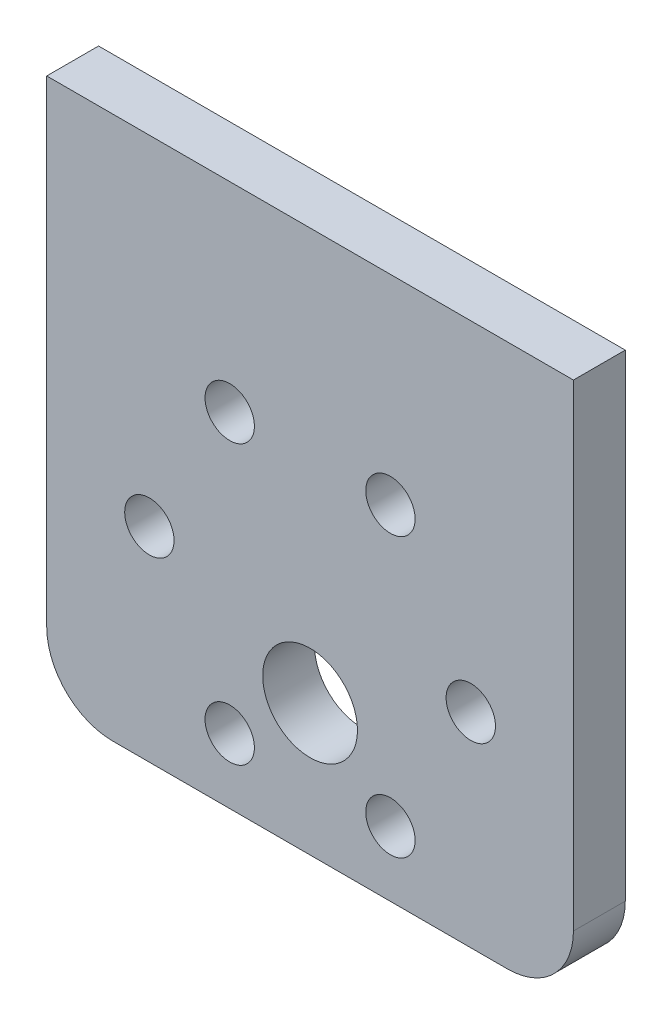
from build123d import *

# Parameters (mm, degrees)
SKETCH1_W                      = 50.8
SKETCH1_H                      = 52.3748
BOSS_EXTRUDE1_DEPTH            = 2.5
F_1_2_0_5_DIAMETER_HOLE1_D     = 9.144
F_3_16_0_1875_DIAMETER_HOLE1_D = 4.7625
FILLET1_R                      = 6.35


with BuildPart() as part:
    # Sketch1 → Boss-Extrude1 (new, symmetric)
    with BuildSketch(Plane.XY):
        Rectangle(SKETCH1_W, SKETCH1_H)
    extrude(amount=BOSS_EXTRUDE1_DEPTH, both=True)

    # 1/2 (0.5) Diameter Hole1 (through all)
    with Locations(Plane.XY.offset(2.5)):
        with Locations((0, -13.4874)):
            Hole(F_1_2_0_5_DIAMETER_HOLE1_D / 2)

    # 3/16 (0.1875) Diameter Hole1 (through all)
    with Locations(Plane(origin=(0, 0, -2.5), x_dir=(-1, 0, 0), z_dir=(0, 0, -1))):
        with Locations((15.5, -6.4874), (7.75, 6.935993759), (-7.75, 6.935993759), (-15.5, -6.4874), (7.75, -19.910793759), (-7.75, -19.910793759)):
            Hole(F_3_16_0_1875_DIAMETER_HOLE1_D / 2)

    # Fillet1
    fillet1_edges = [part.edges().sort_by_distance(p)[0] for p in [
        (25.4, -26.1874, 0),
        (-25.4, -26.1874, 0),
    ]]
    fillet(fillet1_edges, radius=FILLET1_R)


solid = part.part
